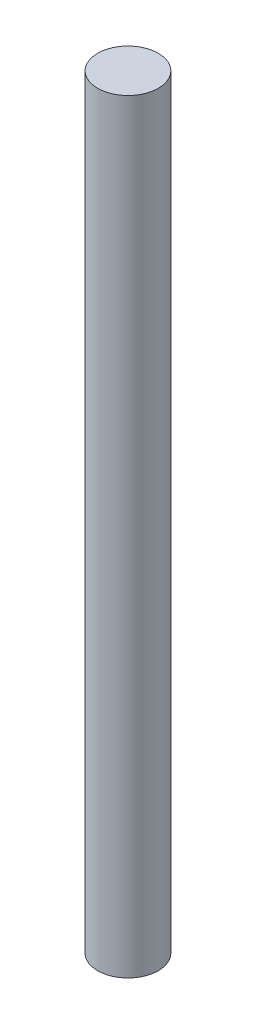
from build123d import *

# Parameters (mm, degrees)
SKETCH1_R           = 3.175
BOSS_EXTRUDE1_DEPTH = 80


with BuildPart() as part:
    # Sketch1 → Boss-Extrude1 (new body)
    with BuildSketch(Plane(origin=(0, 0, 0), x_dir=(1, 0, 0), z_dir=(0, 1, 0))):
        with Locations(Location((0, 0, 0), (0, 0, 270))):
            Circle(SKETCH1_R)
    extrude(amount=BOSS_EXTRUDE1_DEPTH)


solid = part.part
